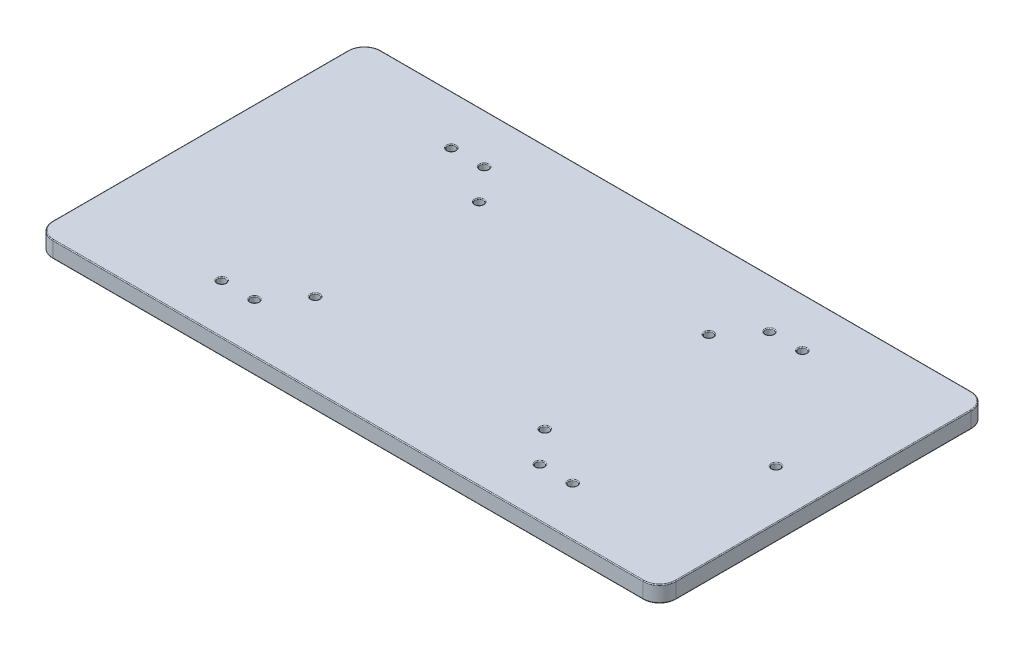
from build123d import *

# Parameters (mm, degrees)
SKETCH1_W           = 190
SKETCH1_H           = 100
SKETCH1_R           = 1.25
BOSS_EXTRUDE1_DEPTH = 5
FILLET1_R           = 5
FILLET2_R           = 0.25


with BuildPart() as part:
    # Sketch1 → Boss-Extrude1 (new body)
    with BuildSketch(Plane(origin=(0, 0, 0), x_dir=(1, 0, 0), z_dir=(0, 1, 0))):
        Rectangle(SKETCH1_W, SKETCH1_H)
        with Locations(Location((-35, 25, 0), (0, 0, 270))):
            Circle(SKETCH1_R, mode=Mode.SUBTRACT)
        with Locations(Location((35, 25, 0), (0, 0, 270))):
            Circle(SKETCH1_R, mode=Mode.SUBTRACT)
        with Locations(Location((35, -25, 0), (0, 0, 270))):
            Circle(SKETCH1_R, mode=Mode.SUBTRACT)
        with Locations(Location((-35, -25, 0), (0, 0, 270))):
            Circle(SKETCH1_R, mode=Mode.SUBTRACT)
        with Locations(Location((80, 0.472364092, 0), (0, 0, 270))):
            Circle(SKETCH1_R, mode=Mode.SUBTRACT)
        with Locations(Location((-53.5, -35, 0), (0, 0, 270))):
            Circle(SKETCH1_R, mode=Mode.SUBTRACT)
        with Locations(Location((-43.5, -35, 0), (0, 0, 270))):
            Circle(SKETCH1_R, mode=Mode.SUBTRACT)
        with Locations(Location((-43.5, 35, 0), (0, 0, 270))):
            Circle(SKETCH1_R, mode=Mode.SUBTRACT)
        with Locations(Location((-53.5, 35, 0), (0, 0, 270))):
            Circle(SKETCH1_R, mode=Mode.SUBTRACT)
        with Locations(Location((43.5, -35, 0), (0, 0, 270))):
            Circle(SKETCH1_R, mode=Mode.SUBTRACT)
        with Locations(Location((53.5, -35, 0), (0, 0, 270))):
            Circle(SKETCH1_R, mode=Mode.SUBTRACT)
        with Locations(Location((43.5, 35, 0), (0, 0, 270))):
            Circle(SKETCH1_R, mode=Mode.SUBTRACT)
        with Locations(Location((53.5, 35, 0), (0, 0, 270))):
            Circle(SKETCH1_R, mode=Mode.SUBTRACT)
    extrude(amount=BOSS_EXTRUDE1_DEPTH)

    # Fillet1
    fillet1_edges = [part.edges().sort_by_distance(p)[0] for p in [
        (95, 2.5, 50),
        (-95, 2.5, 50),
        (-95, 2.5, -50),
        (95, 2.5, -50),
    ]]
    fillet(fillet1_edges, radius=FILLET1_R)

    # Fillet2
    fillet2_edges = [part.edges().sort_by_distance(p)[0] for p in [
        (53.5, 5, 33.75),
        (-35, 5, 23.75),
        (53.5, 0, 33.75),
        (-53.5, 0, -36.25),
        (35, 5, -26.25),
        (-35, 0, -26.25),
        (80, 0, -1.722364092),
        (-53.5, 0, 33.75),
        (-43.5, 0, 33.75),
        (-43.5, 0, -36.25),
        (43.5, 0, 33.75),
        (43.5, 0, -36.25),
        (53.5, 0, -36.25),
        (35, 0, 23.75),
        (35, 0, -26.25),
        (-35, 0, 23.75),
        (35, 5, 23.75),
        (53.5, 5, -36.25),
        (43.5, 5, -36.25),
        (43.5, 5, 33.75),
        (-43.5, 5, -36.25),
        (0, 0, 50),
        (0, 5, 50),
        (-43.5, 5, 33.75),
        (95, 0, 0),
        (-95, 0, 0),
        (0, 0, -50),
        (93.535533906, 0, 48.535533906),
        (93.535533906, 0, -48.535533906),
        (-93.535533906, 0, -48.535533906),
        (-93.535533906, 0, 48.535533906),
        (-53.5, 5, 33.75),
        (-95, 5, 0),
        (95, 5, 0),
        (0, 5, -50),
        (93.535533906, 5, 48.535533906),
        (93.535533906, 5, -48.535533906),
        (-93.535533906, 5, -48.535533906),
        (80, 5, -1.722364092),
        (-93.535533906, 5, 48.535533906),
        (-35, 5, -26.25),
        (-53.5, 5, -36.25),
    ]]
    fillet(fillet2_edges, radius=FILLET2_R)


solid = part.part
